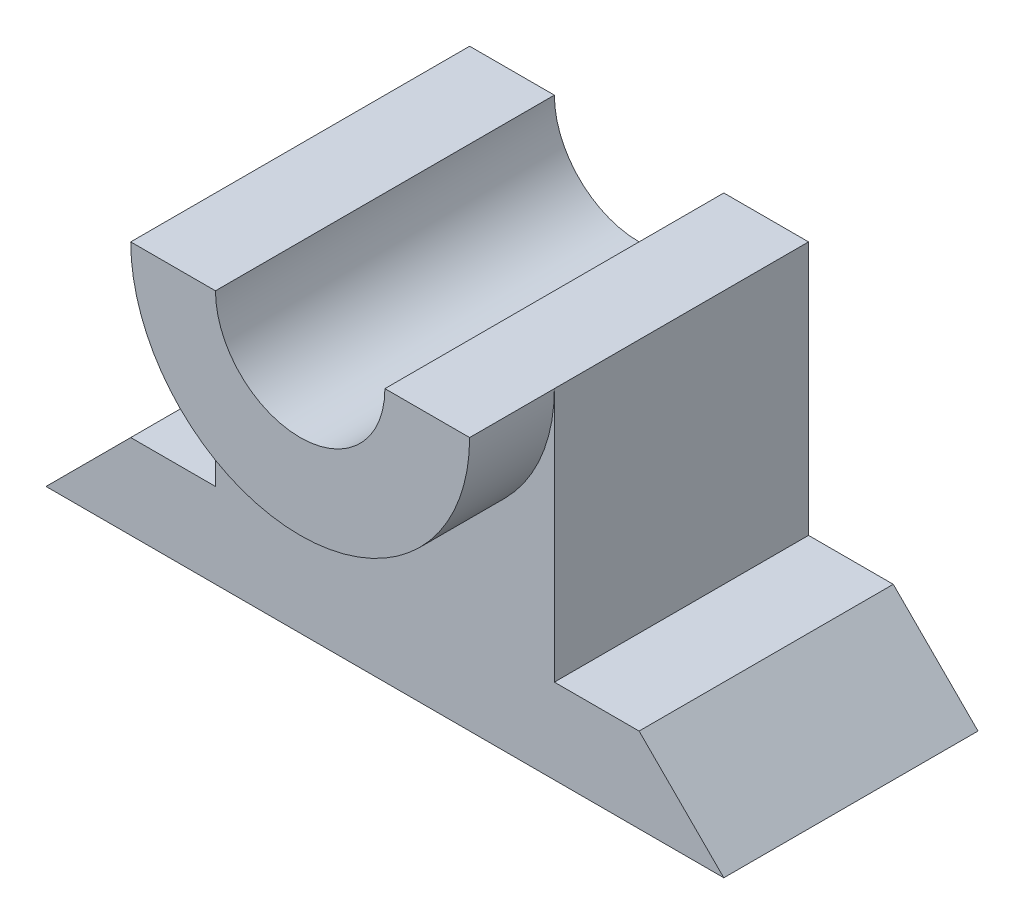
from build123d import *

# Parameters (mm, degrees)
BOSS_EXTRUDE1_DEPTH = 30
BOSS_EXTRUDE2_START = 10
BOSS_EXTRUDE2_DEPTH = 10


with BuildPart() as part:
    # Sketch1 → Boss-Extrude1 (new body)
    with BuildSketch(Plane.XY):
        with BuildLine():
            Line((-40, 0), (40, 0))
            Line((40, 0), (30, 10))
            Line((30, 10), (20, 10))
            Line((20, 10), (20, 40))
            Line((20, 40), (10, 40))
            ThreePointArc((10, 40), (0, 30), (-10, 40))
            Line((-10, 40), (-20, 40))
            Line((-20, 40), (-20, 10))
            Line((-20, 10), (-30, 10))
            Line((-30, 10), (-40, 0))
        make_face()
    extrude(amount=-BOSS_EXTRUDE1_DEPTH)

    # Sketch4 → Boss-Extrude2 (add)
    with BuildSketch(Plane.XY.offset(BOSS_EXTRUDE2_START)):
        with BuildLine():
            Line((-20, 40), (-10, 40))
            ThreePointArc((-10, 40), (0, 30), (10, 40))
            Line((10, 40), (20, 40))
            ThreePointArc((20, 40), (0, 20), (-20, 40))
        make_face()
    extrude(amount=-BOSS_EXTRUDE2_DEPTH)


solid = part.part
